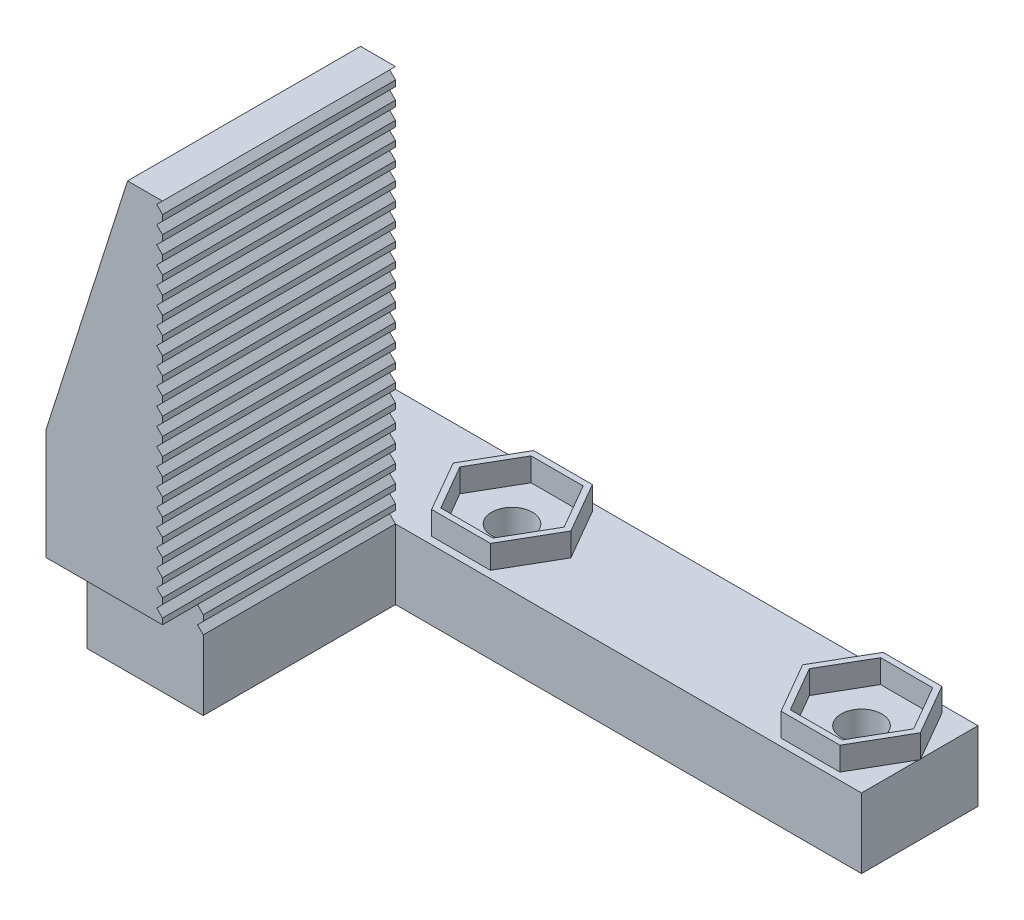
from build123d import *

# Parameters (mm, degrees)
BOSS_EXTRUDE1_DEPTH = 20
SKETCH2_R           = 1.75
BOSS_EXTRUDE2_DEPTH = 6
CUT_EXTRUDE1_DEPTH  = 20
BOSS_EXTRUDE3_DEPTH = 2
SKETCH5_W           = 10
SKETCH5_H           = 8.5
CUT_EXTRUDE2_DEPTH  = 3.5


with BuildPart() as part:
    # Sketch1 → Boss-Extrude1 (new body)
    with BuildSketch(Plane.XY):
        Polygon((0, 0), (0, 40), (-3, 40), (-10, 18), (-10, 0), align=None)
    extrude(amount=BOSS_EXTRUDE1_DEPTH)

    # Sketch2 → Boss-Extrude2 (add)
    with BuildSketch(Plane.XZ):
        Polygon((-10, 0), (-10, -10), (40, -10), (40, 0), (0, 0), align=None)
        with Locations(Location((35, -5, 0), (0, 0, 270))):
            Circle(SKETCH2_R, mode=Mode.SUBTRACT)
        with Locations(Location((5, -5, 0), (0, 0, 270))):
            Circle(SKETCH2_R, mode=Mode.SUBTRACT)
    extrude(amount=-BOSS_EXTRUDE2_DEPTH)

    # Sketch3 → Cut-Extrude1 (cut)
    with BuildSketch(Plane.XY.offset(20)):
        Polygon((0, 6), (-0.5, 6.5), (0, 7), align=None)
        Polygon((0, 7.5), (-0.5, 8), (0, 8.5), align=None)
        Polygon((0, 9), (-0.5, 9.5), (0, 10), align=None)
        Polygon((0, 10.5), (-0.5, 11), (0, 11.5), align=None)
        Polygon((0, 12), (-0.5, 12.5), (0, 13), align=None)
        Polygon((0, 13.5), (-0.5, 14), (0, 14.5), align=None)
        Polygon((0, 15), (-0.5, 15.5), (0, 16), align=None)
        Polygon((0, 16.5), (-0.5, 17), (0, 17.5), align=None)
        Polygon((0, 18), (-0.5, 18.5), (0, 19), align=None)
        Polygon((0, 19.5), (-0.5, 20), (0, 20.5), align=None)
        Polygon((0, 21), (-0.5, 21.5), (0, 22), align=None)
        Polygon((0, 22.5), (-0.5, 23), (0, 23.5), align=None)
        Polygon((0, 24), (-0.5, 24.5), (0, 25), align=None)
        Polygon((0, 25.5), (-0.5, 26), (0, 26.5), align=None)
        Polygon((0, 27), (-0.5, 27.5), (0, 28), align=None)
        Polygon((0, 28.5), (-0.5, 29), (0, 29.5), align=None)
        Polygon((0, 30), (-0.5, 30.5), (0, 31), align=None)
        Polygon((0, 31.5), (-0.5, 32), (0, 32.5), align=None)
        Polygon((0, 33), (-0.5, 33.5), (0, 34), align=None)
        Polygon((0, 34.5), (-0.5, 35), (0, 35.5), align=None)
        Polygon((0, 36), (-0.5, 36.5), (0, 37), align=None)
        Polygon((0, 37.5), (-0.5, 38), (0, 38.5), align=None)
        Polygon((0, 39), (-0.5, 39.5), (0, 40), align=None)
        Polygon((0, 40.5), (-0.5, 41), (0, 41.5), align=None)
    extrude(amount=-CUT_EXTRUDE1_DEPTH, mode=Mode.SUBTRACT)

    # Sketch4 → Boss-Extrude3 (add)
    # profile 1 of 2: a face of its own
    with BuildSketch(Plane(origin=(0, 6, 0), x_dir=(1, 0, 0), z_dir=(0, 1, 0))):
        Polygon((10.051814855, 5), (7.525907428, 9.375), (2.474092572, 9.375), (-0.051814855, 5), (2.474092572, 0.625), (7.525907428, 0.625), align=None)
        Polygon((9.474464586, 5), (7.237232293, 8.875), (2.762767707, 8.875), (0.525535414, 5), (2.762767707, 1.125), (7.237232293, 1.125), align=None, mode=Mode.SUBTRACT)
    # profile 2 of 2: a face of its own
    with BuildSketch(Plane(origin=(0, 6, 0), x_dir=(1, 0, 0), z_dir=(0, 1, 0))):
        Polygon((40.051814855, 5), (37.525907428, 9.375), (32.474092572, 9.375), (29.948185145, 5), (32.474092572, 0.625), (37.525907428, 0.625), align=None)
        Polygon((39.474464586, 5), (37.237232293, 8.875), (32.762767707, 8.875), (30.525535414, 5), (32.762767707, 1.125), (37.237232293, 1.125), align=None, mode=Mode.SUBTRACT)
    extrude(amount=BOSS_EXTRUDE3_DEPTH)

    # Sketch5 → Cut-Extrude2 (cut)
    with BuildSketch(Plane.XY.offset(20)):
        with Locations((-5, 4.25)):
            Rectangle(SKETCH5_W, SKETCH5_H)
    extrude(amount=-CUT_EXTRUDE2_DEPTH, mode=Mode.SUBTRACT)


solid = part.part
